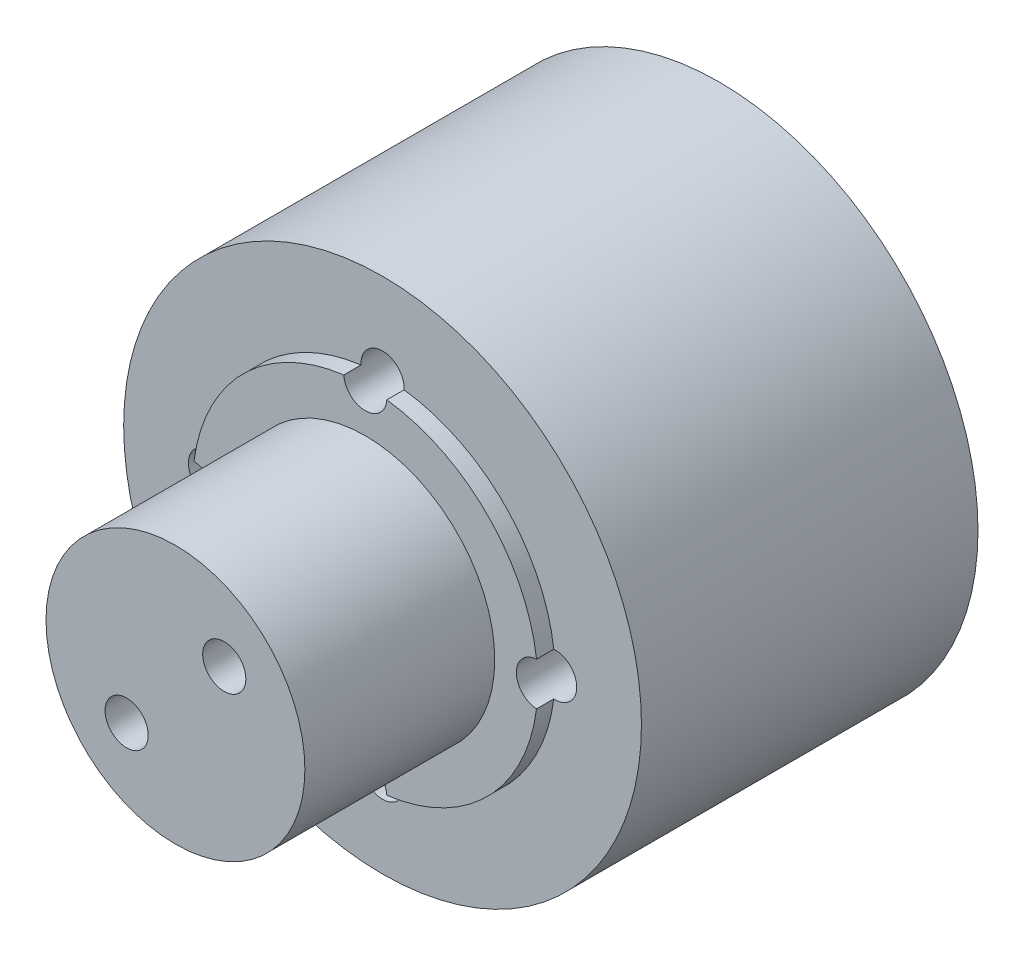
from build123d import *

# Parameters (mm, degrees)
SKETCH_1_R      = 15
EXTRUDE_1_DEPTH = 19.5
SKETCH_2_R      = 10
EXTRUDE_2_DEPTH = 1
SKETCH_3_R      = 7.5
EXTRUDE_3_DEPTH = 11
M3X0_52_D       = 2.5
M3X0_51_D       = 2.5
M3X0_51_DEPTH   = 8
M3X0_51_TIP     = 0.751075774


with BuildPart() as part:
    # Эскиз1 → Бобышка-Вытянуть1 (new body)
    with BuildSketch(Plane.XY):
        Circle(SKETCH_1_R)
    extrude(amount=EXTRUDE_1_DEPTH)

    # Эскиз2 → Бобышка-Вытянуть2 (add)
    with BuildSketch(Plane.XY.offset(19.5)):
        Circle(SKETCH_2_R)
    extrude(amount=EXTRUDE_2_DEPTH)

    # Эскиз3 → Бобышка-Вытянуть3 (add)
    with BuildSketch(Plane.XY.offset(20.5)):
        Circle(SKETCH_3_R)
    extrude(amount=EXTRUDE_3_DEPTH)

    # Отверстие обработанное метчиком M3x0.52 (through all)
    with Locations(Plane(origin=(0, 0, 0), x_dir=(-1, 0, 0), z_dir=(0, 0, -1))):
        with Locations((0, 10), (10, 0), (-10, 0), (0, -10)):
            Hole(M3X0_52_D / 2)

    # Отверстие обработанное метчиком M3x0.51
    with Locations(Plane.XY.offset(31.5)):
        with Locations((-2.828427125, -2.828427125), (2.828427125, 2.828427125)):
            Hole(M3X0_51_D / 2, depth=M3X0_51_DEPTH)
            with Locations((0, 0, -(M3X0_51_DEPTH + M3X0_51_TIP / 2))):  # 118° drill point
                Cone(0, M3X0_51_D / 2, M3X0_51_TIP, mode=Mode.SUBTRACT)


solid = part.part
